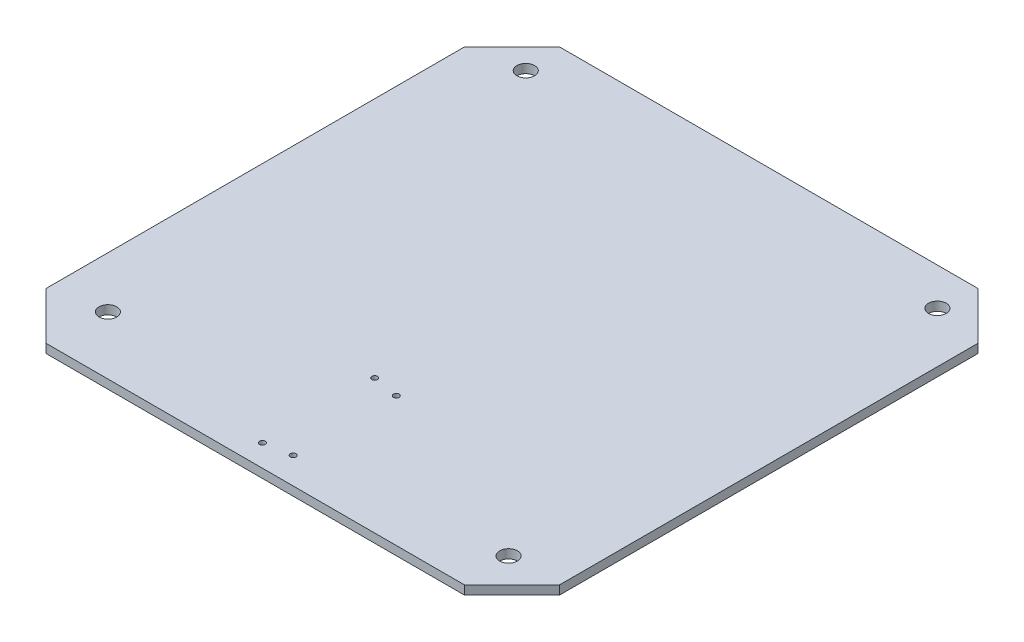
from build123d import *

# Parameters (mm, degrees)
SKETCH1_W             = 92
SKETCH1_H             = 92
SKETCH1_R             = 0.51
BOSS_EXTRUDE1_DEPTH   = 1.59
CHAMFER1_SIZE         = 8.5
F_1_0MM_DOWEL_HOLE1_D = 3.18


with BuildPart() as part:
    # Sketch1 → Boss-Extrude1 (new body)
    with BuildSketch(Plane(origin=(0, 0, 0), x_dir=(1, 0, 0), z_dir=(0, 1, 0))):
        Rectangle(SKETCH1_W, SKETCH1_H)
        with Locations(Location((-2.67, -21.93, 0), (0, 0, 270))):
            Circle(SKETCH1_R, mode=Mode.SUBTRACT)
        with Locations(Location((2.03, -22.76, 0), (0, 0, 270))):
            Circle(SKETCH1_R, mode=Mode.SUBTRACT)
        with Locations(Location((-2.67, -42.06, 0), (0, 0, 270))):
            Circle(SKETCH1_R, mode=Mode.SUBTRACT)
        with Locations(Location((2.03, -41.24, 0), (0, 0, 270))):
            Circle(SKETCH1_R, mode=Mode.SUBTRACT)
    extrude(amount=BOSS_EXTRUDE1_DEPTH)

    # Chamfer1
    chamfer1_edges = [part.edges().sort_by_distance(p)[0] for p in [
        (46, 0.795, 46),
        (-46, 0.795, 46),
        (-46, 0.795, -46),
        (46, 0.795, -46),
    ]]
    chamfer(chamfer1_edges, length=CHAMFER1_SIZE)

    # Ø1.0mm Dowel Hole1 (through all)
    with Locations(Plane(origin=(0, 1.59, 0), x_dir=(1, 0, 0), z_dir=(0, 1, 0))):
        with Locations((-36.820611538, -35.589152958), (36.943757396, -37.559486686), (36.943757396, 39.283528698), (-36.820611538, 39.283528698)):
            Hole(F_1_0MM_DOWEL_HOLE1_D / 2)


solid = part.part
